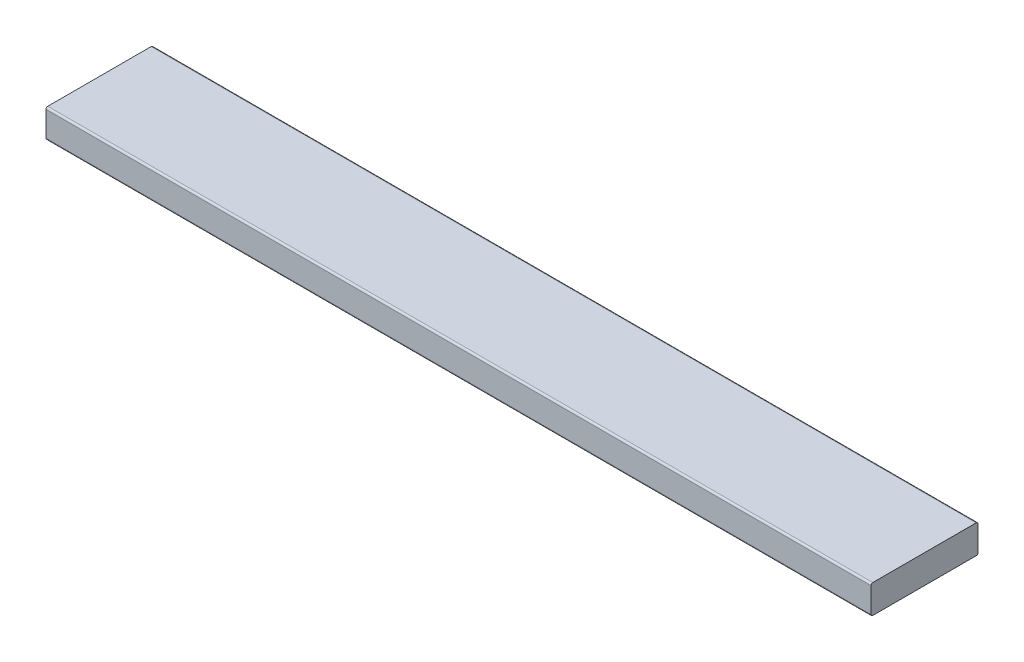
from build123d import *

# Parameters (mm, degrees)
SKETCH2_W           = 120
SKETCH2_H           = 32
BOSS_EXTRUDE1_DEPTH = 462.5
FILLET1_R           = 2


with BuildPart() as part:
    # Sketch2 → Boss-Extrude1 (new, symmetric)
    with BuildSketch(Plane(origin=(0, 0, 0), x_dir=(0, 0, -1), z_dir=(1, 0, 0))):
        Rectangle(SKETCH2_W, SKETCH2_H)
    extrude(amount=BOSS_EXTRUDE1_DEPTH, both=True)

    # Fillet1
    fillet1_edges = [part.edges().sort_by_distance(p)[0] for p in [
        (0, -16, -60),
        (0, -16, 60),
        (0, 16, 60),
        (0, 16, -60),
    ]]
    fillet(fillet1_edges, radius=FILLET1_R)


solid = part.part
